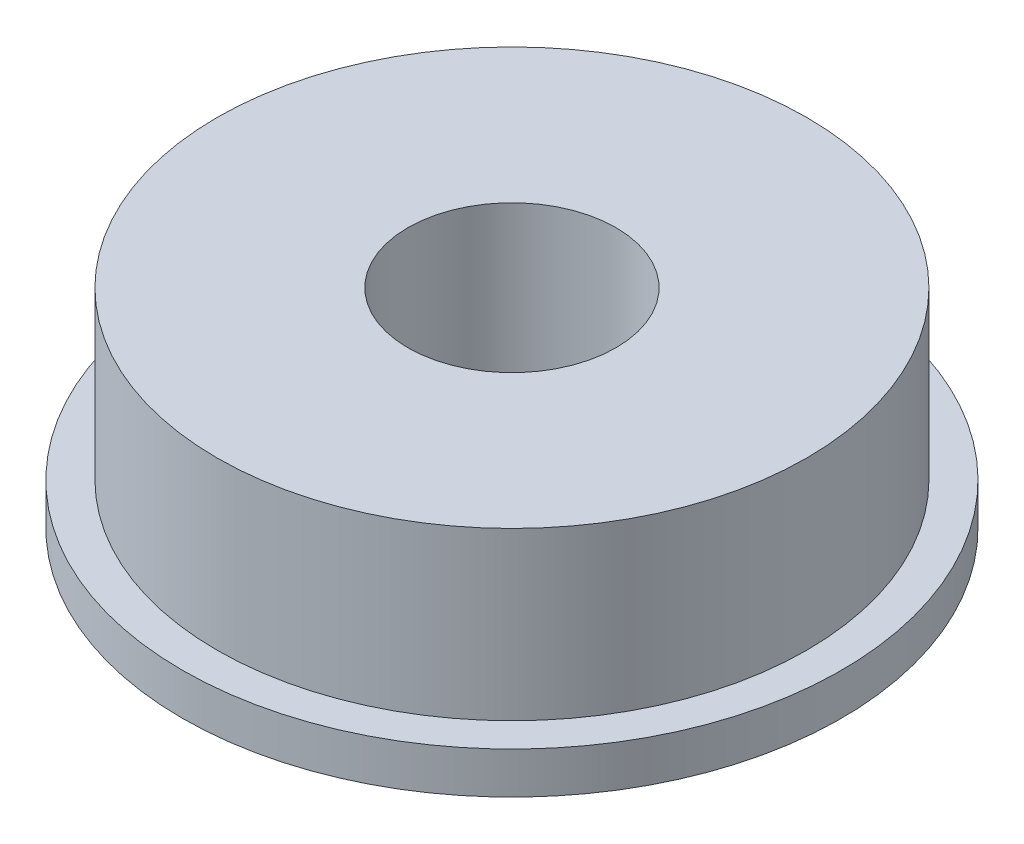
from build123d import *

# Parameters (mm, degrees)
SKETCH_1_R          = 9.5
EXTRUDE_1_DEPTH     = 1.2
SKETCH_2_R          = 8.5
EXTRUDE_2_DEPTH     = 4.8
SKETCH_3_R          = 3
CUT_EXTRUDE_1_DEPTH = 20


with BuildPart() as part:
    # 草图1 → 凸台-拉伸1 (new body)
    with BuildSketch(Plane(origin=(0, 0, 0), x_dir=(1, 0, 0), z_dir=(0, 1, 0))):
        with Locations(Location((0, 0, 0), (0, 0, 270))):
            Circle(SKETCH_1_R)
    extrude(amount=EXTRUDE_1_DEPTH)

    # 草图2 → 凸台-拉伸2 (add)
    with BuildSketch(Plane(origin=(0, 1.2, 0), x_dir=(1, 0, 0), z_dir=(0, 1, 0))):
        with Locations(Location((0, 0, 0), (0, 0, 270))):
            Circle(SKETCH_2_R)
    extrude(amount=EXTRUDE_2_DEPTH)

    # 草图3 → 切除-拉伸1 (cut)
    with BuildSketch(Plane(origin=(0, 6, 0), x_dir=(1, 0, 0), z_dir=(0, 1, 0))):
        with Locations(Location((0, 0, 0), (0, 0, 270))):
            Circle(SKETCH_3_R)
    extrude(amount=-CUT_EXTRUDE_1_DEPTH, mode=Mode.SUBTRACT)


solid = part.part
